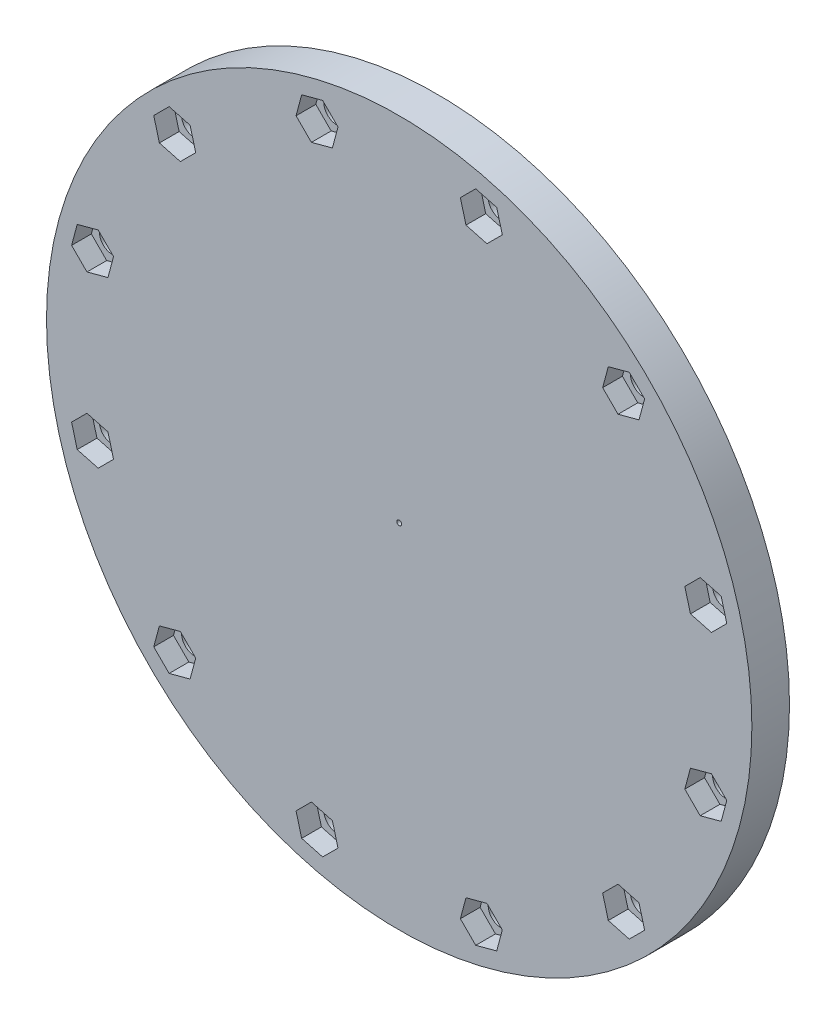
from build123d import *

# Parameters (mm, degrees)
SKETCH1_R            = 75
BOSS_EXTRUDE1_DEPTH  = 8
M5_CLEARANCE_HOLE1_D = 5.5
CUT_EXTRUDE2_DEPTH   = 4.2
SKETCH11_R           = 45.85
CUT_EXTRUDE3_DEPTH   = 6
SKETCH12_R           = 60.7695
SKETCH12_R_2         = 53.6575
CUT_EXTRUDE4_DEPTH   = 4.1656
SKETCH14_R           = 0.5
CENTER_HOLE_DEPTH    = 1


with BuildPart() as part:
    # Sketch1 → Boss-Extrude1 (new body)
    with BuildSketch(Plane.XY):
        Circle(SKETCH1_R)
    extrude(amount=BOSS_EXTRUDE1_DEPTH)

    # M5 Clearance Hole1 (through all)
    with Locations(Plane(origin=(0, 0, 0), x_dir=(-1, 0, 0), z_dir=(0, 0, -1))):
        with Locations((-17.470285544, -65.199993275), (-47.72970773, 47.72970773), (65.199993275, -17.470285544), (47.72970773, -47.72970773), (-65.199993275, 17.470285544), (-17.470285544, 65.199993275), (-65.199993275, -17.470285544), (-47.72970773, -47.72970773), (17.470285544, -65.199993275), (65.199993275, 17.470285544), (47.72970773, 47.72970773), (17.470285544, 65.199993275)):
            Hole(M5_CLEARANCE_HOLE1_D / 2)

    # Sketch6 → Cut-Extrude2 (cut)
    with BuildSketch(Plane(origin=(0, 0, 8), x_dir=(-1, 0, 0), z_dir=(0, 0, -1))):
        Polygon((-43.268287443, 46.534273767), (-44.463721406, 50.995694054), (-48.925141693, 52.191128017), (-52.191128017, 48.925141693), (-50.995694054, 44.463721406), (-46.534273767, 43.268287443), align=None)
        Polygon((-13.008865258, 66.395427237), (-16.274851582, 69.661413561), (-20.736271868, 68.465979598), (-21.931705831, 64.004559312), (-18.665719507, 60.738572988), (-14.204299221, 61.934006951), align=None)
        Polygon((21.931705831, 64.004559312), (20.736271868, 68.465979598), (16.274851582, 69.661413561), (13.008865258, 66.395427237), (14.204299221, 61.934006951), (18.665719507, 60.738572988), align=None)
        Polygon((50.995694054, 44.463721406), (52.191128017, 48.925141693), (48.925141693, 52.191128017), (44.463721406, 50.995694054), (43.268287443, 46.534273767), (46.534273767, 43.268287444), align=None)
        Polygon((66.395427237, 13.008865258), (69.661413561, 16.274851582), (68.465979598, 20.736271868), (64.004559312, 21.931705831), (60.738572988, 18.665719507), (61.934006951, 14.204299221), align=None)
        Polygon((64.004559312, -21.931705831), (68.465979598, -20.736271868), (69.661413561, -16.274851582), (66.395427237, -13.008865258), (61.934006951, -14.204299221), (60.738572988, -18.665719507), align=None)
        Polygon((44.463721406, -50.995694054), (48.925141693, -52.191128017), (52.191128017, -48.925141693), (50.995694054, -44.463721406), (46.534273767, -43.268287443), (43.268287444, -46.534273767), align=None)
        Polygon((13.008865258, -66.395427237), (16.274851582, -69.661413561), (20.736271868, -68.465979598), (21.931705831, -64.004559312), (18.665719507, -60.738572988), (14.204299221, -61.934006951), align=None)
        Polygon((-21.931705831, -64.004559312), (-20.736271868, -68.465979598), (-16.274851582, -69.661413561), (-13.008865258, -66.395427237), (-14.204299221, -61.934006951), (-18.665719507, -60.738572988), align=None)
        Polygon((-50.995694054, -44.463721406), (-52.191128017, -48.925141693), (-48.925141693, -52.191128017), (-44.463721406, -50.995694054), (-43.268287443, -46.534273767), (-46.534273767, -43.268287443), align=None)
        Polygon((-66.395427237, -13.008865258), (-69.661413561, -16.274851582), (-68.465979598, -20.736271868), (-64.004559312, -21.931705831), (-60.738572988, -18.665719507), (-61.934006951, -14.204299221), align=None)
        Polygon((-64.004559312, 21.931705831), (-68.465979598, 20.736271868), (-69.661413561, 16.274851582), (-66.395427237, 13.008865258), (-61.934006951, 14.204299221), (-60.738572988, 18.665719507), align=None)
    extrude(amount=CUT_EXTRUDE2_DEPTH, mode=Mode.SUBTRACT)

    # Sketch11 → Cut-Extrude3 (cut)
    with BuildSketch(Plane(origin=(0, 0, 0), x_dir=(-1, 0, 0), z_dir=(0, 0, -1))):
        Circle(SKETCH11_R)
    extrude(amount=-CUT_EXTRUDE3_DEPTH, mode=Mode.SUBTRACT)

    # Sketch12 → Cut-Extrude4 (cut)
    with BuildSketch(Plane(origin=(0, 0, 0), x_dir=(-1, 0, 0), z_dir=(0, 0, -1))):
        Circle(SKETCH12_R)
        Circle(SKETCH12_R_2, mode=Mode.SUBTRACT)
    extrude(amount=-CUT_EXTRUDE4_DEPTH, mode=Mode.SUBTRACT)

    # Sketch14 → center hole (cut)
    with BuildSketch(Plane.XY.offset(8)):
        Circle(SKETCH14_R)
    extrude(amount=-CENTER_HOLE_DEPTH, mode=Mode.SUBTRACT)


solid = part.part
